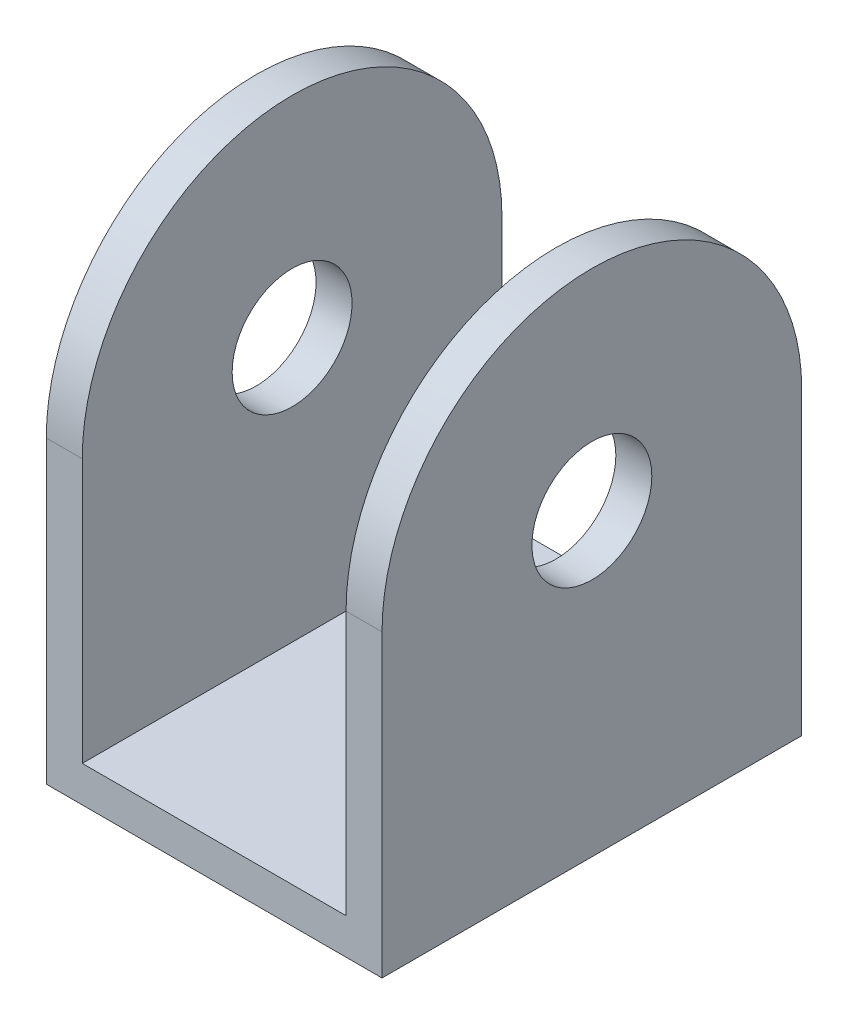
from build123d import *

# Parameters (mm, degrees)
SKETCH1_W           = 22
SKETCH1_H           = 35
BOSS_EXTRUDE1_DEPTH = 3
SKETCH2_W           = 35
SKETCH2_H           = 3
BOSS_EXTRUDE6_DEPTH = 3
BOSS_EXTRUDE7_START = 3
SKETCH4_W           = 35
SKETCH4_H           = 3
BOSS_EXTRUDE7_DEPTH = 3


with BuildPart() as part:
    # Sketch1 → Boss-Extrude1 (new body)
    with BuildSketch(Plane(origin=(0, 0, 0), x_dir=(1, 0, 0), z_dir=(0, 1, 0))):
        with Locations((-45.186046512, -0.081395349)):
            Rectangle(SKETCH1_W, SKETCH1_H)
    extrude(amount=BOSS_EXTRUDE1_DEPTH)

    # Sketch2 → Boss-Extrude6 (add)
    with BuildSketch(Plane(origin=(-34.186046512, 0, 0), x_dir=(0, 0, -1), z_dir=(1, 0, 0))):
        with BuildLine():
            ThreePointArc((17.418604651, 25), (-0.081395349, 42.5), (-17.581395349, 25))
            Line((-17.581395349, 25), (-5.081395349, 25))
            ThreePointArc((-5.081395349, 25), (-0.081395349, 30), (4.918604651, 25))
            Line((4.918604651, 25), (17.418604651, 25))
        make_face()
        with BuildLine():
            Line((-5.081395349, 25), (-17.581395349, 25))
            ThreePointArc((-17.581395349, 25), (-0.081395349, 7.5), (17.418604651, 25))
            Line((17.418604651, 25), (4.918604651, 25))
            ThreePointArc((4.918604651, 25), (-0.081395349, 20), (-5.081395349, 25))
        make_face()
        with BuildLine():
            Line((-17.581395349, 25), (-17.581395349, 3))
            Line((-17.581395349, 3), (17.418604651, 3))
            Line((17.418604651, 3), (17.418604651, 25))
            ThreePointArc((17.418604651, 25), (-0.081395349, 7.5), (-17.581395349, 25))
        make_face()
        with Locations((-0.081395349, 1.5)):
            Rectangle(SKETCH2_W, SKETCH2_H)
    extrude(amount=BOSS_EXTRUDE6_DEPTH)

    # Sketch4 → Boss-Extrude7 (add)
    with BuildSketch(Plane.ZY.offset(56.186046512).offset(BOSS_EXTRUDE7_START)):
        with BuildLine():
            ThreePointArc((17.581395349, 25), (0.081395349, 42.5), (-17.418604651, 25))
            Line((-17.418604651, 25), (-4.918604651, 25))
            ThreePointArc((-4.918604651, 25), (0.081395349, 30), (5.081395349, 25))
            Line((5.081395349, 25), (17.581395349, 25))
        make_face()
        with BuildLine():
            Line((-4.918604651, 25), (-17.418604651, 25))
            ThreePointArc((-17.418604651, 25), (0.081395349, 7.5), (17.581395349, 25))
            Line((17.581395349, 25), (5.081395349, 25))
            ThreePointArc((5.081395349, 25), (0.081395349, 20), (-4.918604651, 25))
        make_face()
        with BuildLine():
            Line((-17.418604651, 25), (-17.418604651, 3))
            Line((-17.418604651, 3), (17.581395349, 3))
            Line((17.581395349, 3), (17.581395349, 25))
            ThreePointArc((17.581395349, 25), (0.081395349, 7.5), (-17.418604651, 25))
        make_face()
        with Locations((0.081395349, 1.5)):
            Rectangle(SKETCH4_W, SKETCH4_H)
    extrude(amount=-BOSS_EXTRUDE7_DEPTH)


solid = part.part
